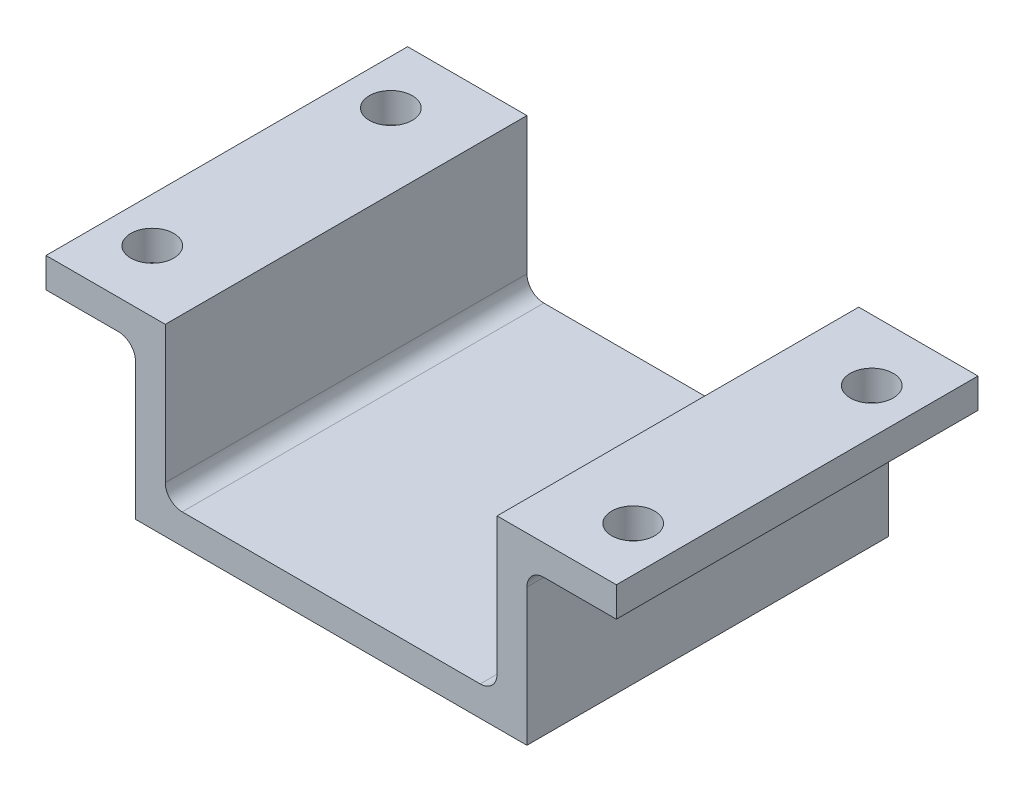
from build123d import *

# Parameters (mm, degrees)
BOSS_EXTRUDE2_DEPTH = 19.250000108
SKETCH3_R           = 2.286
CUT_EXTRUDE1_DEPTH  = 41.930807193
FILLET1_R           = 1.8


with BuildPart() as part:
    # Sketch1<3> → Boss-Extrude2 (new, symmetric)
    with BuildSketch(Plane.XY):
        Polygon((17.662500108, -17.662500108), (-17.662500108, -17.662500108), (-17.662500108, -1.27), (-30.362500108, -1.27), (-30.362500108, -4.445), (-20.837500108, -4.445), (-20.837500108, -20.837500108), (20.837500108, -20.837500108), (20.837500108, -4.445), (30.362500108, -4.445), (30.362500108, -1.27), (17.662500108, -1.27), align=None)
    extrude(amount=BOSS_EXTRUDE2_DEPTH, both=True)

    # Sketch3 → Cut-Extrude1 (cut, through all)
    with BuildSketch(Plane(origin=(0, -1.27, 0), x_dir=(1, 0, 0), z_dir=(0, 1, 0))):
        with Locations((-25.600000108, 12.7)):
            Circle(SKETCH3_R)
        with Locations((-25.600000108, -12.7)):
            Circle(SKETCH3_R)
        with Locations((25.600000108, 12.7)):
            Circle(SKETCH3_R)
        with Locations((25.600000108, -12.7)):
            Circle(SKETCH3_R)
    extrude(amount=-CUT_EXTRUDE1_DEPTH, mode=Mode.SUBTRACT)

    # Fillet1
    fillet1_edges = [part.edges().sort_by_distance(p)[0] for p in [
        (-17.662500108, -17.662500108, 0),
        (17.662500108, -17.662500108, 0),
        (20.837500108, -4.445, 0),
        (-20.837500108, -4.445, 0),
    ]]
    fillet(fillet1_edges, radius=FILLET1_R)


solid = part.part
